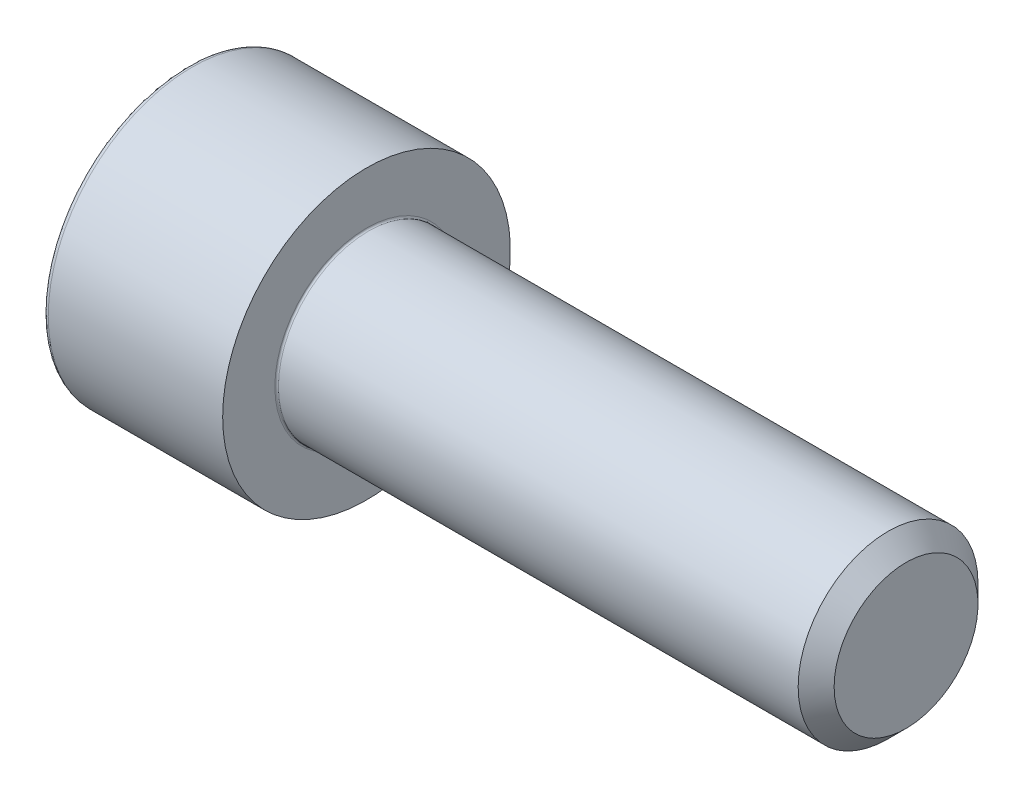
from build123d import *

# Parameters (mm, degrees)
FILLET1_R   = 0.1
FILLET2_R   = 0.3
HEX_2_DEPTH = 1.3


with BuildPart() as part:
    # BodySke → Base-Revolve (revolve)
    with BuildSketch(Plane.XY, mode=Mode.PRIVATE) as base_revolve_sk:
        Polygon((0, 0), (0, 8), (10, 8), (10, 5), (39, 5), (40, 4), (40, 0), align=None)
    revolve(base_revolve_sk.sketch.rotate(Axis((-31.75, 0, 0), (1, 0, 0)), 90), axis=Axis((-31.75, 0, 0), (1, 0, 0)))

    # Fillet1
    fillet1_edges = [part.edges().sort_by_distance(p)[0] for p in [
        (10, 0, -5),
    ]]
    fillet(fillet1_edges, radius=FILLET1_R)

    # Fillet2
    fillet2_edges = [part.edges().sort_by_distance(p)[0] for p in [
        (0, 0, -8),
    ]]
    fillet(fillet2_edges, radius=FILLET2_R)

    # Sketch2 → Hex-PreBroach (revolve, cut)
    with BuildSketch(Plane.XY, mode=Mode.PRIVATE) as hex_prebroach_sk:
        Polygon((0, 4), (1.3, 4), (3.609401077, 0), (0, 0), align=None)
    revolve(hex_prebroach_sk.sketch.rotate(Axis((0, 0, 0), (1, 0, 0)), 90), axis=Axis((0, 0, 0), (1, 0, 0)), mode=Mode.SUBTRACT)

    # Sketch3 → Hex 2 (cut)
    with BuildSketch(Plane(origin=(0, 0, 0), x_dir=(0, 0.500000000000001, 0.866025403784438), z_dir=(-1, 0, 0))):
        Polygon((2.309401077, 4), (-2.309401077, 4), (-4.618802154, 0), (-2.309401077, -4), (2.309401077, -4), (4.618802154, 0), align=None)
    extrude(amount=-HEX_2_DEPTH, mode=Mode.SUBTRACT)


solid = part.part
